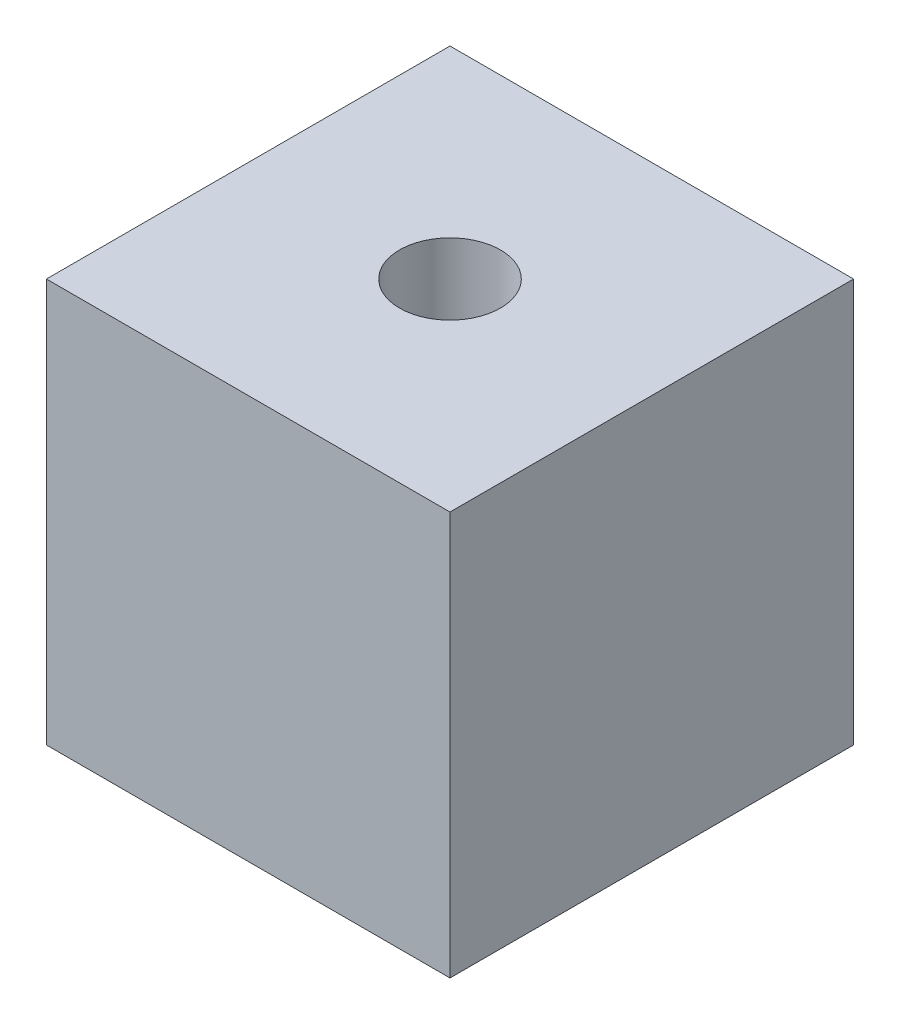
from build123d import *

# Parameters (mm, degrees)
SKETCH1_W           = 20
SKETCH1_H           = 20
SKETCH1_R           = 2.5
BOSS_EXTRUDE1_DEPTH = 20


with BuildPart() as part:
    # Sketch1 → Boss-Extrude1 (new body)
    with BuildSketch(Plane(origin=(0, 0, 0), x_dir=(1, 0, 0), z_dir=(0, 1, 0))):
        with Locations((10, -10)):
            Rectangle(SKETCH1_W, SKETCH1_H)
        with Locations(Location((10, -10, 0), (0, 0, 270))):
            Circle(SKETCH1_R, mode=Mode.SUBTRACT)
    extrude(amount=BOSS_EXTRUDE1_DEPTH)


solid = part.part
